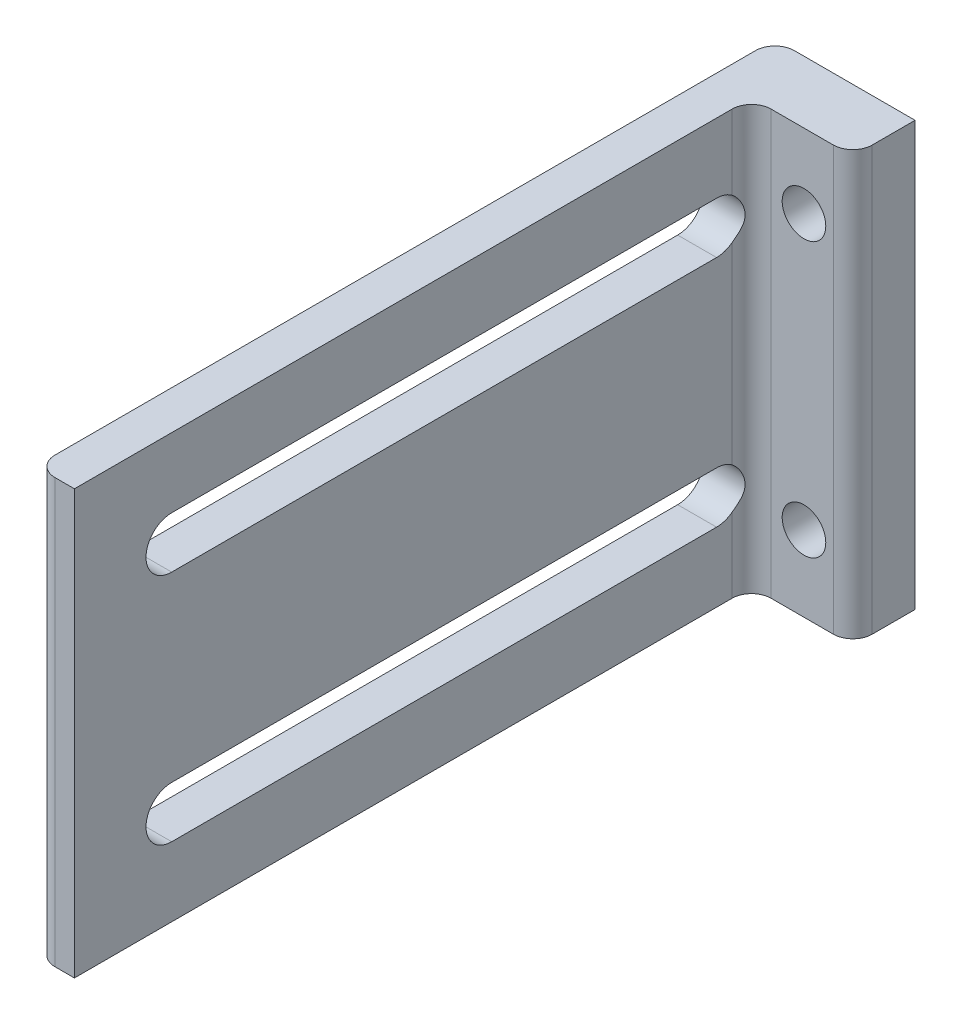
from build123d import *

# Parameters (mm, degrees)
SKETCH1_W           = 9
SKETCH1_H           = 27.215298634
BOSS_EXTRUDE1_DEPTH = 4
SKETCH2_W           = 2.5
SKETCH2_H           = 27.215298634
BOSS_EXTRUDE2_DEPTH = 43.5
FILLET1_R           = 1.25
CUT_EXTRUDE1_REACH  = 57.921
SKETCH7_R           = 1.4
CUT_EXTRUDE2_DEPTH  = 75.363842374


with BuildPart() as part:
    # Sketch1 → Boss-Extrude1 (new body)
    with BuildSketch(Plane.XY):
        with Locations((-48.865, -14.497649317)):
            Rectangle(SKETCH1_W, SKETCH1_H)
    extrude(amount=BOSS_EXTRUDE1_DEPTH)

    # Sketch2 → Boss-Extrude2 (add)
    with BuildSketch(Plane.XY.offset(4)):
        with Locations((-52.115, -14.497649317)):
            Rectangle(SKETCH2_W, SKETCH2_H)
    extrude(amount=BOSS_EXTRUDE2_DEPTH)

    # Fillet1
    fillet1_edges = [part.edges().sort_by_distance(p)[0] for p in [
        (-50.865, -14.497649317, 4),
        (-53.365, -14.497649317, 47.5),
        (-44.365, -14.497649317, 4),
        (-53.365, -14.497649317, 0),
    ]]
    fillet(fillet1_edges, radius=FILLET1_R)

    # Sketch6 → Cut-Extrude1 (cut, up to next)
    with BuildSketch(Plane.ZY.offset(53.365), mode=Mode.PRIVATE) as cut_extrude1_sk1:
        with BuildLine():
            Line((6.25, -20.35), (41.25, -20.35))
            ThreePointArc((41.25, -20.35), (42.9, -22), (41.25, -23.65))
            Line((41.25, -23.65), (6.25, -23.65))
            ThreePointArc((6.25, -23.65), (4.6, -22), (6.25, -20.35))
        make_face()
    cut_extrude1_tool1 = extrude(cut_extrude1_sk1.sketch, amount=-CUT_EXTRUDE1_REACH, mode=Mode.PRIVATE) & part.part
    # Sketch6 → Cut-Extrude1 (cut, up to next)
    with BuildSketch(Plane.ZY.offset(53.365), mode=Mode.PRIVATE) as cut_extrude1_sk2:
        with BuildLine():
            Line((6.25, -5.35), (41.25, -5.35))
            ThreePointArc((41.25, -5.35), (42.9, -7), (41.25, -8.65))
            Line((41.25, -8.65), (6.25, -8.65))
            ThreePointArc((6.25, -8.65), (4.6, -7), (6.25, -5.35))
        make_face()
    cut_extrude1_tool2 = extrude(cut_extrude1_sk2.sketch, amount=-CUT_EXTRUDE1_REACH, mode=Mode.PRIVATE) & part.part
    add(cut_extrude1_tool1.solids().sort_by_distance((-53.365, -22, 23.75))[0], mode=Mode.SUBTRACT)
    add(cut_extrude1_tool2.solids().sort_by_distance((-53.365, -7, 23.75))[0], mode=Mode.SUBTRACT)

    # Sketch7 → Cut-Extrude2 (cut, through all)
    with BuildSketch(Plane.XY.offset(4)):
        with Locations((-47.5, -23.25)):
            Circle(SKETCH7_R)
        with Locations((-47.5, -5.65)):
            Circle(SKETCH7_R)
    extrude(amount=-CUT_EXTRUDE2_DEPTH, mode=Mode.SUBTRACT)


solid = part.part
